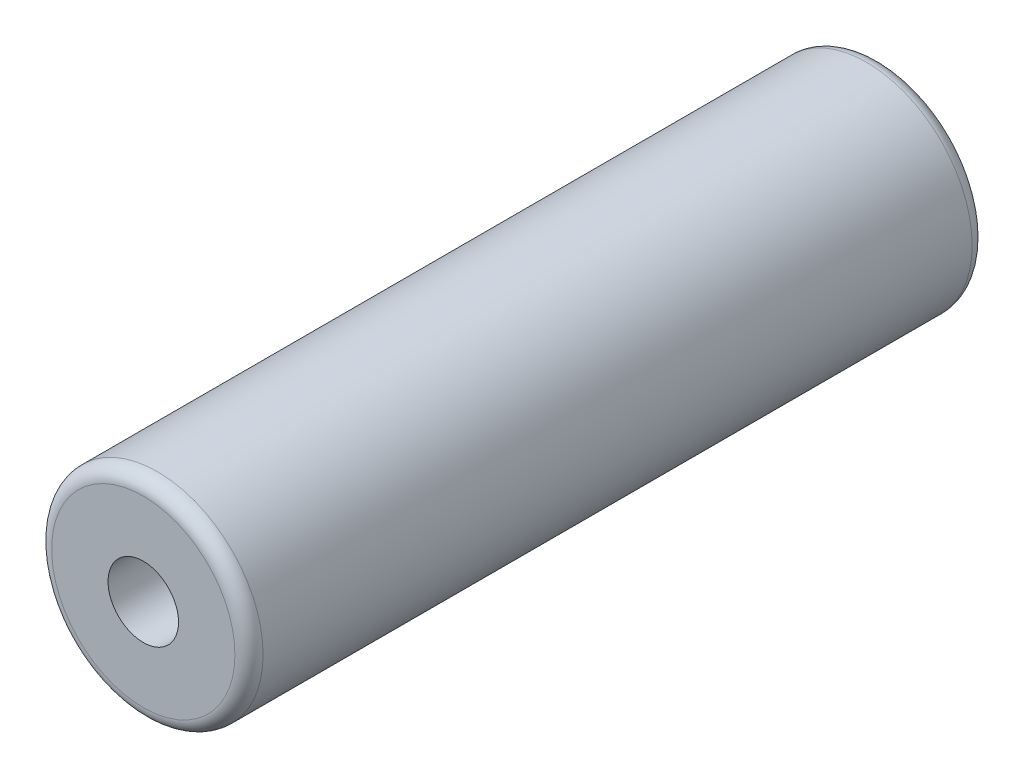
from build123d import *

# Parameters (mm, degrees)
CROQUIS1_R              = 7.5
SALIENTE_EXTRUIR1_DEPTH = 26.15
REDONDEO1_R             = 1


with BuildPart() as part:
    # Croquis1 → Saliente-Extruir1 (new, symmetric)
    with BuildSketch(Plane.XY):
        Circle(CROQUIS1_R)
    extrude(amount=SALIENTE_EXTRUIR1_DEPTH, both=True)

    # Croquis2 → Taladro roscado M61 (revolve, cut)
    with BuildSketch(Plane(origin=(0, 0, 26.15), x_dir=(0, -1, 0), z_dir=(1, 0, 0))):
        Polygon((0, 0), (0, 18.502151548), (2.5, 17), (2.5, 0), align=None)
    taladro_roscado_m61 = revolve(axis=Axis((0, 0, 32.5), (0, 0, -1)), mode=Mode.SUBTRACT)

    # Redondeo1
    redondeo1_edges = [part.edges().sort_by_distance(p)[0] for p in [
        (-7.5, 0, -26.15),
        (-7.5, 0, 26.15),
    ]]
    fillet(redondeo1_edges, radius=REDONDEO1_R)

    # Simetría1: Taladro roscado M61 across plane
    add(taladro_roscado_m61.mirror(Plane.XY), mode=Mode.SUBTRACT)


solid = part.part
